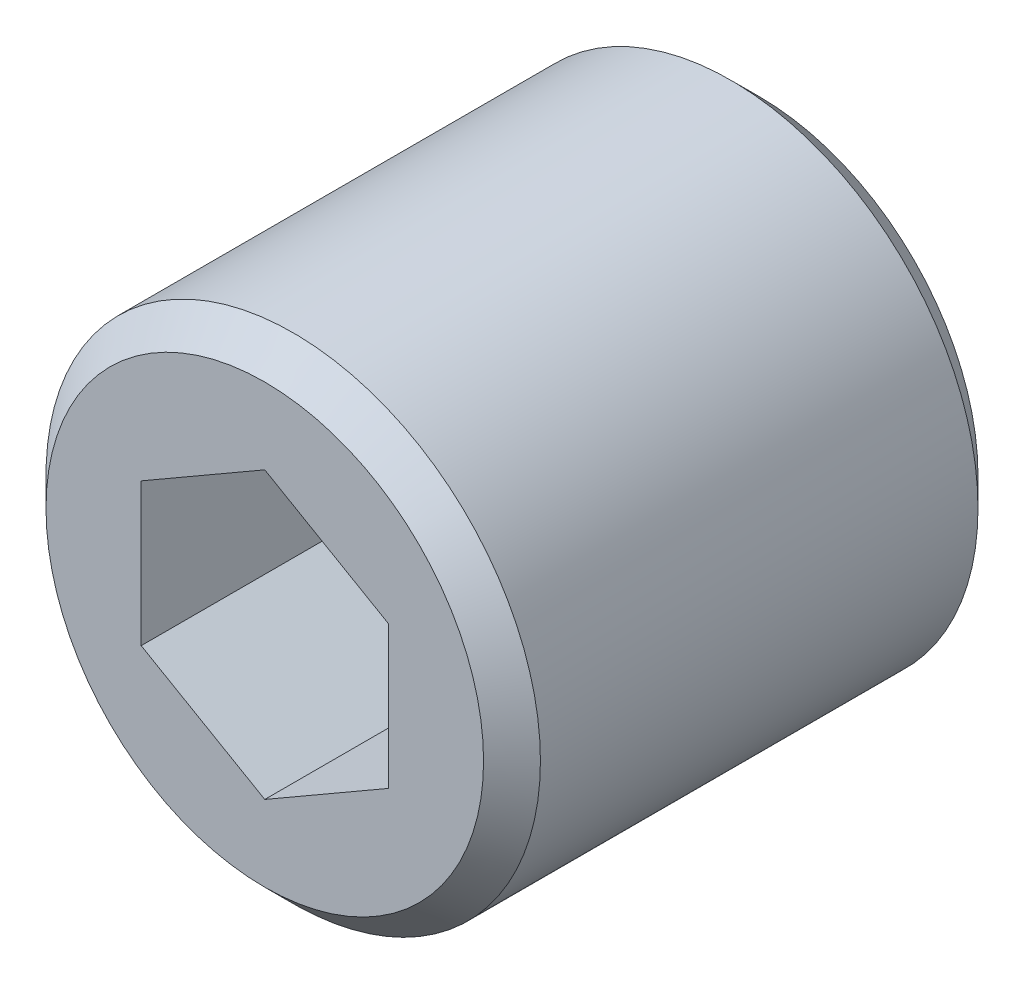
from build123d import *

# Parameters (mm, degrees)
SZKIC3_R                    = 3.009401077
DODANIE_WYCI_GNI_CIE1_DEPTH = 6


with BuildPart() as part:
    # Szkic1 → Obrót1 (revolve)
    with BuildSketch(Plane(origin=(0, 0, 0), x_dir=(0, 0, -1), z_dir=(1, 0, 0)), mode=Mode.PRIVATE) as obr_t1_sk:
        Polygon((-8, 0), (-8, 3.54), (-7.54, 4), (-0.46, 4), (0, 3.54), (0, 0), align=None)
    revolve(obr_t1_sk.sketch.rotate(Axis((0, 0, 0), (0, 0, 1)), 270), axis=Axis((0, 0, 0), (0, 0, 1)))

    # Szkic2 → Wycięcie-obrót1 (revolve, cut)
    with BuildSketch(Plane(origin=(0, 0, 0), x_dir=(0, 0, -1), z_dir=(1, 0, 0)), mode=Mode.PRIVATE) as wyci_cie_obr_t1_sk:
        Polygon((-8, 0), (-8, 2.809401077), (-4, 2.809401077), (-2.377991532, 0), align=None)
    revolve(wyci_cie_obr_t1_sk.sketch.rotate(Axis((0, 0, 2.377991532), (0, 0, 1)), 270), axis=Axis((0, 0, 2.377991532), (0, 0, 1)), mode=Mode.SUBTRACT)

    # Szkic3 → Dodanie-wyciągnięcie1 (add)
    with BuildSketch(Plane.XY.offset(8)):
        Circle(SZKIC3_R)
        Polygon((-2, 1.154700538), (-2, -1.154700538), (0, -2.309401077), (2, -1.154700538), (2, 1.154700538), (0, 2.309401077), align=None, mode=Mode.SUBTRACT)
    extrude(amount=-DODANIE_WYCI_GNI_CIE1_DEPTH)


solid = part.part
